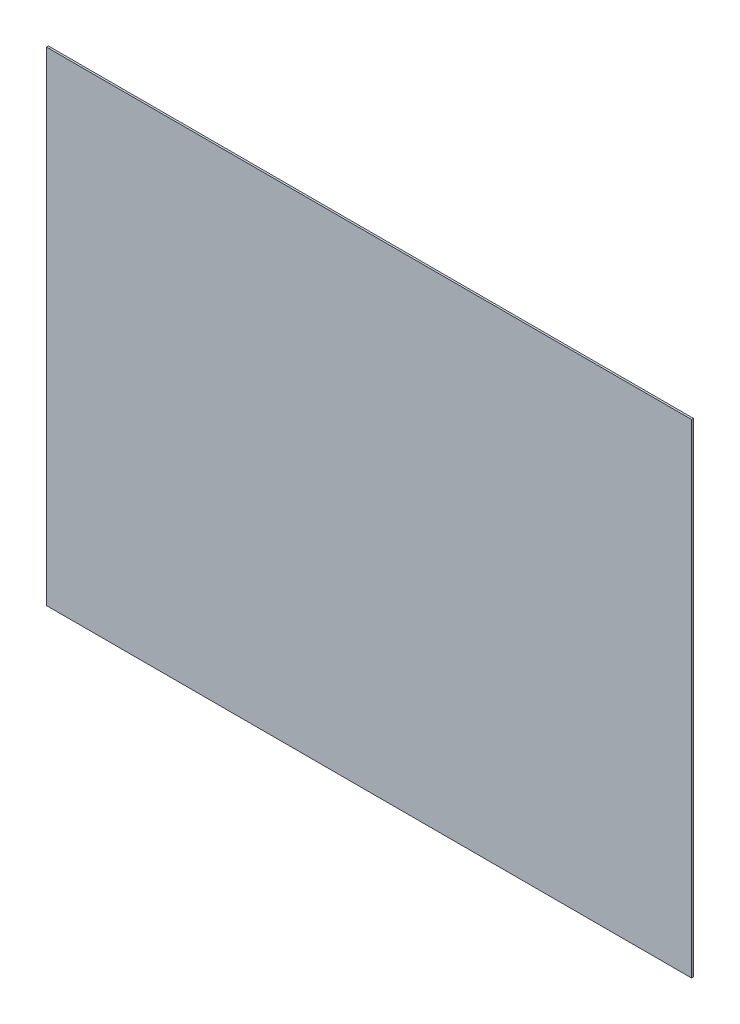
from build123d import *

# Parameters (mm, degrees)
ESQUISSE1_W        = 400
ESQUISSE1_H        = 300
BOSS_EXTRU_1_DEPTH = 1.2


with BuildPart() as part:
    # Esquisse1 → Boss.-Extru.1 (new body)
    with BuildSketch(Plane.XY):
        Rectangle(ESQUISSE1_W, ESQUISSE1_H)
    extrude(amount=BOSS_EXTRU_1_DEPTH)


solid = part.part
